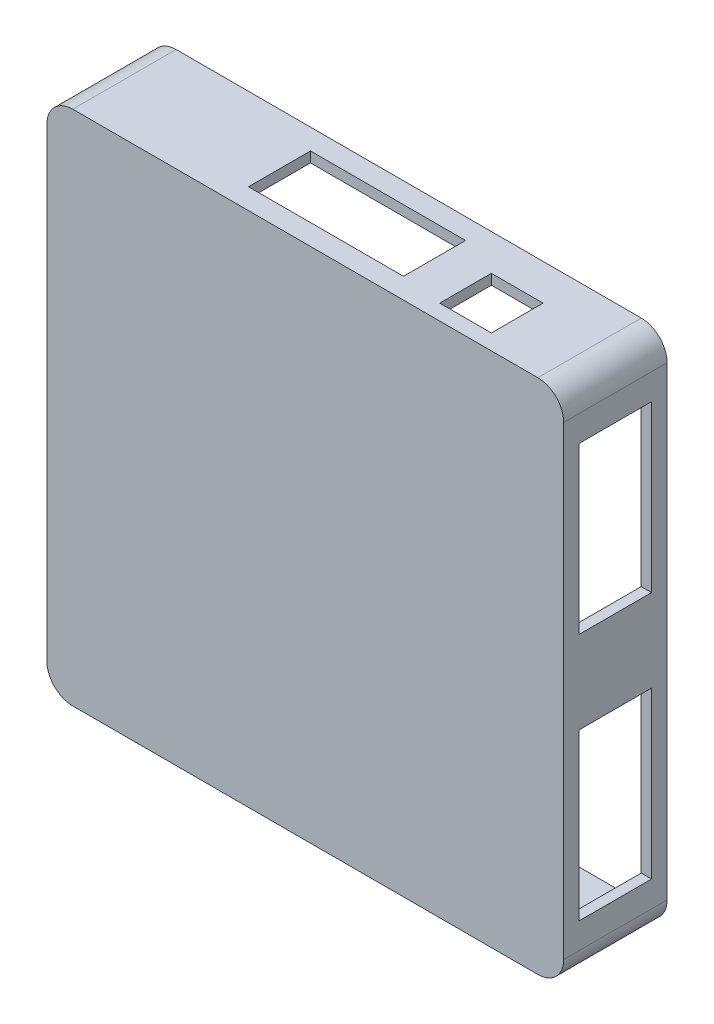
from build123d import *

# Parameters (mm, degrees)
SKETCH_2_W          = 100
SKETCH_2_H          = 100
EXTRUDE_1_DEPTH     = 20
SKETCH_3_W          = 10
SKETCH_3_H          = 10
CUT_EXTRUDE_1_DEPTH = 12
SKETCH_4_W          = 96
SKETCH_4_H          = 96
CUT_EXTRUDE_2_DEPTH = 17
SKETCH_5_W          = 82.5
SKETCH_5_H          = 82.5
CUT_EXTRUDE_3_DEPTH = 1
FILLET_1_R          = 5
FILLET_2_R          = 5
SKETCH_8_W          = 14
SKETCH_8_H          = 32
CUT_EXTRUDE_4_DEPTH = 114.578166916
SKETCH_9_W          = 20
SKETCH_9_H          = 15
CUT_EXTRUDE_5_DEPTH = 10
SKETCH_10_W         = 30
SKETCH_10_H         = 12
CUT_EXTRUDE_6_DEPTH = 10


with BuildPart() as part:
    # 草图2 → 凸台-拉伸1 (new body)
    with BuildSketch(Plane.XY):
        Rectangle(SKETCH_2_W, SKETCH_2_H)
    extrude(amount=EXTRUDE_1_DEPTH)

    # 草图3 → 切除-拉伸1 (cut)
    with BuildSketch(Plane(origin=(0, 50, 0), x_dir=(1, 0, 0), z_dir=(0, 1, 0))):
        with Locations((28, -12)):
            Rectangle(SKETCH_3_W, SKETCH_3_H)
    extrude(amount=-CUT_EXTRUDE_1_DEPTH, mode=Mode.SUBTRACT)

    # 草图4 → 切除-拉伸2 (cut)
    with BuildSketch(Plane(origin=(0, 0, 0), x_dir=(-1, 0, 0), z_dir=(0, 0, -1))):
        Rectangle(SKETCH_4_W, SKETCH_4_H)
    extrude(amount=-CUT_EXTRUDE_2_DEPTH, mode=Mode.SUBTRACT)

    # 草图5 → 切除-拉伸3 (cut)
    with BuildSketch(Plane(origin=(0, 0, 17), x_dir=(-1, 0, 0), z_dir=(0, 0, -1))):
        Rectangle(SKETCH_5_W, SKETCH_5_H)
    extrude(amount=-CUT_EXTRUDE_3_DEPTH, mode=Mode.SUBTRACT)

    # 圆角1
    fillet_1_edges = [part.edges().sort_by_distance(p)[0] for p in [
        (48, 48, 8.5),
        (-48, 48, 8.5),
        (-48, -48, 8.5),
        (48, -48, 8.5),
    ]]
    fillet(fillet_1_edges, radius=FILLET_1_R)

    # 圆角2
    fillet_2_edges = [part.edges().sort_by_distance(p)[0] for p in [
        (50, -50, 10),
        (-50, -50, 10),
        (-50, 50, 10),
        (50, 50, 10),
    ]]
    fillet(fillet_2_edges, radius=FILLET_2_R)

    # 草图8 → 切除-拉伸4 (cut, through all)
    with BuildSketch(Plane.ZY.offset(50)):
        with Locations((10, -24)):
            Rectangle(SKETCH_8_W, SKETCH_8_H)
        with Locations((10, 24)):
            Rectangle(SKETCH_8_W, SKETCH_8_H)
    extrude(amount=-CUT_EXTRUDE_4_DEPTH, mode=Mode.SUBTRACT)

    # 草图9 → 切除-拉伸5 (cut)
    with BuildSketch(Plane.XZ.offset(50)):
        with Locations((0, 10)):
            Rectangle(SKETCH_9_W, SKETCH_9_H)
    extrude(amount=-CUT_EXTRUDE_5_DEPTH, mode=Mode.SUBTRACT)

    # 草图10 → 切除-拉伸6 (cut)
    with BuildSketch(Plane(origin=(0, 50, 0), x_dir=(1, 0, 0), z_dir=(0, 1, 0))):
        with Locations((0, -10)):
            Rectangle(SKETCH_10_W, SKETCH_10_H)
    extrude(amount=-CUT_EXTRUDE_6_DEPTH, mode=Mode.SUBTRACT)


solid = part.part
